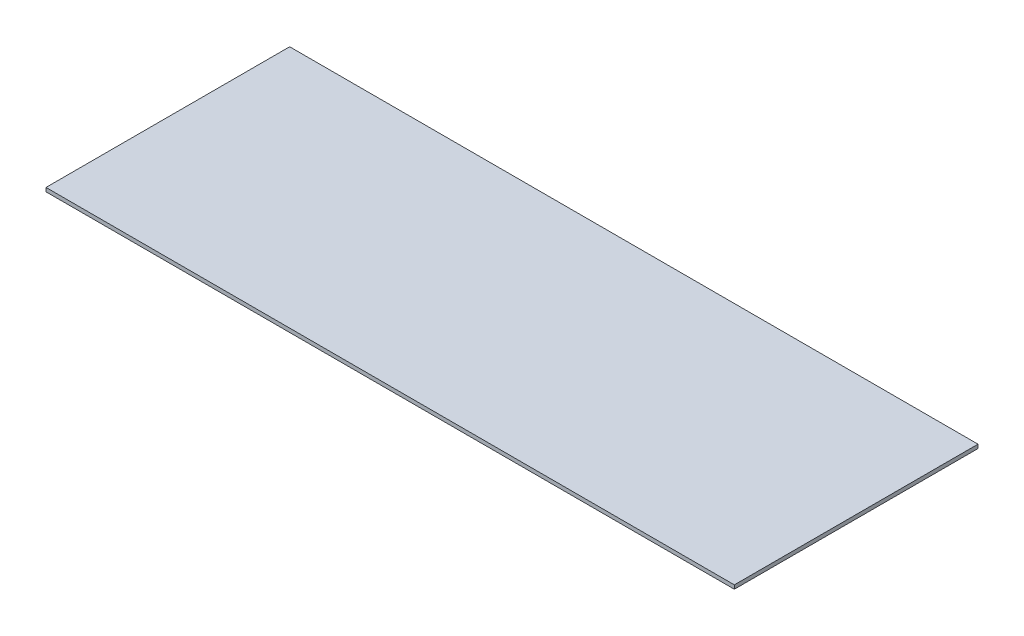
from build123d import *

# Parameters (mm, degrees)
SKETCH1_W           = 228.727
SKETCH1_H           = 80.9625
BOSS_EXTRUDE1_DEPTH = 1.27


with BuildPart() as part:
    # Sketch1 → Boss-Extrude1 (new body)
    with BuildSketch(Plane(origin=(0, 0, 0), x_dir=(1, 0, 0), z_dir=(0, 1, 0))):
        with Locations((114.3635, 40.48125)):
            Rectangle(SKETCH1_W, SKETCH1_H)
    extrude(amount=BOSS_EXTRUDE1_DEPTH)


solid = part.part
